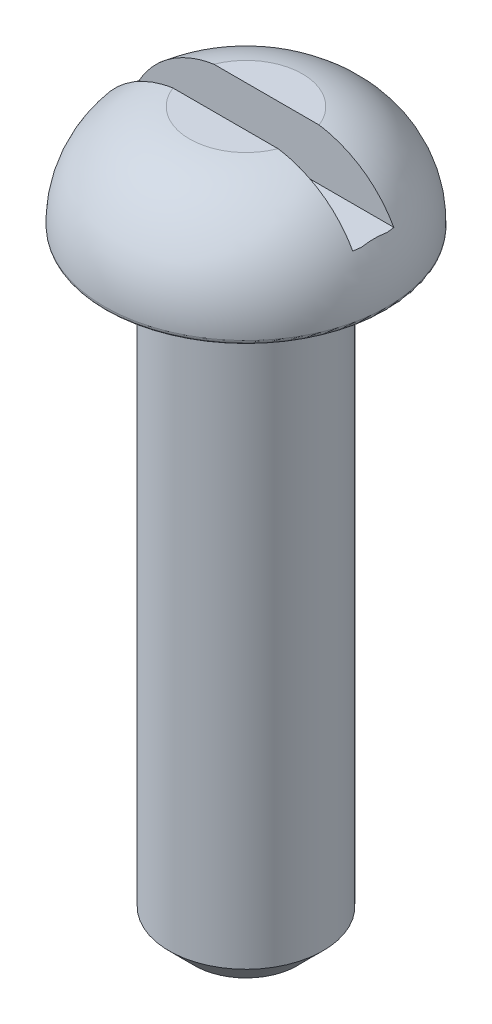
from build123d import *

# Parameters (mm, degrees)
FILLET_1_R          = 0.1
SKETCH_3_W          = 5
SKETCH_3_H          = 0.8
CUT_EXTRUDE_2_DEPTH = 1


with BuildPart() as part:
    # Эскиз1 → Повернуть1 (revolve)
    with BuildSketch(Plane.XY):
        with BuildLine():
            Line((2.75, 11.9), (1.5, 11.9))
            Line((1.5, 11.9), (1.5, 0.5))
            Line((1.5, 0.5), (1, 0))
            Line((1, 0), (0, 0))
            Line((0, 0), (0, 14))
            Line((0, 14), (1.1, 14))
            ThreePointArc((1.1, 14), (2.333466256, 13.270937772), (2.75, 11.9))
        make_face()
    revolve(axis=Axis((0, 0, 0), (0, 1, 0)))

    # Скругление1
    fillet_1_edges = [part.edges().sort_by_distance(p)[0] for p in [
        (-2.75, 11.9, 0),
    ]]
    fillet(fillet_1_edges, radius=FILLET_1_R)

    # Эскиз3 → Вырез-Вытянуть2 (cut)
    with BuildSketch(Plane(origin=(0, 14, 0), x_dir=(-1, 0, 0), z_dir=(0, 1, 0))):
        Rectangle(SKETCH_3_W, SKETCH_3_H)
    extrude(amount=-CUT_EXTRUDE_2_DEPTH, mode=Mode.SUBTRACT)


solid = part.part
